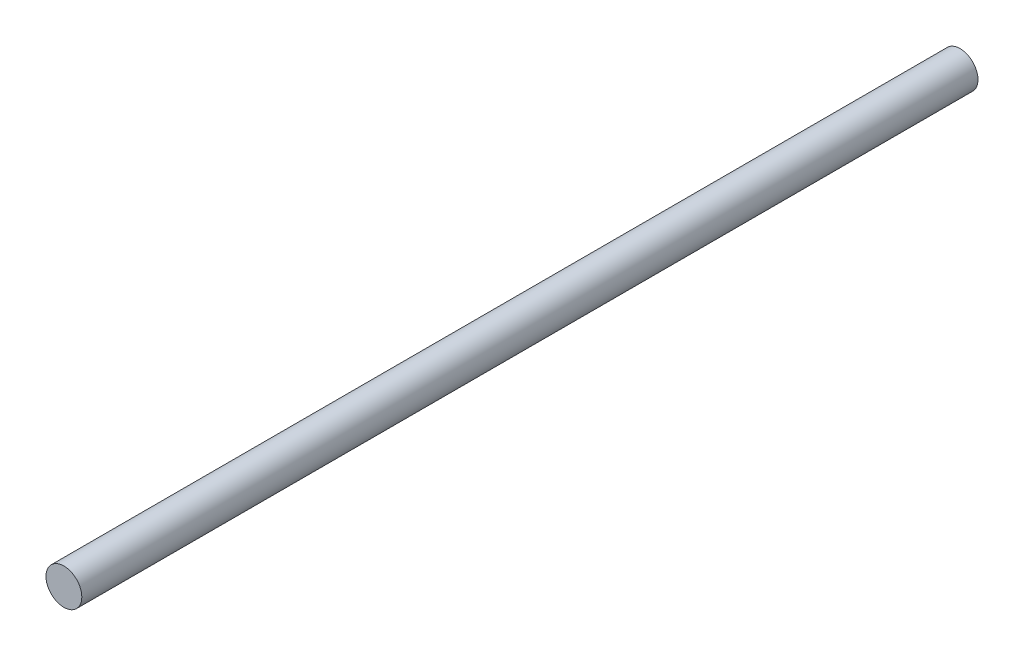
from build123d import *

# Parameters (mm, degrees)
SKETCH2_R           = 1.5
BOSS_EXTRUDE1_DEPTH = 75


with BuildPart() as part:
    # Sketch2 → Boss-Extrude1 (new body)
    with BuildSketch(Plane.XY):
        Circle(SKETCH2_R)
    extrude(amount=BOSS_EXTRUDE1_DEPTH)


solid = part.part
